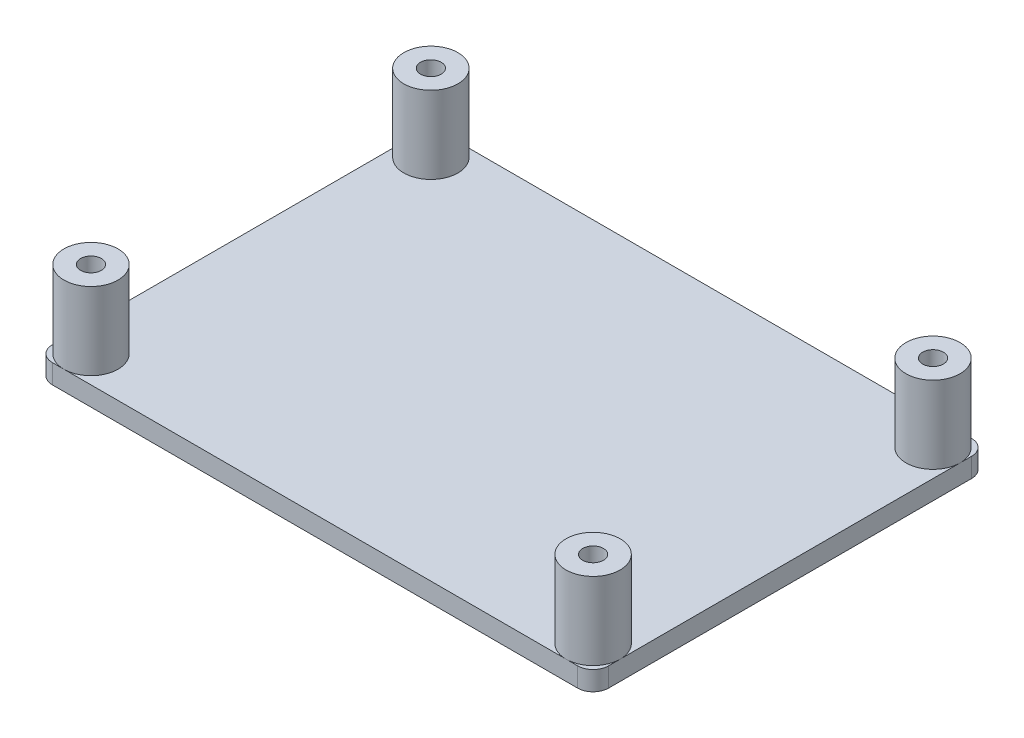
from build123d import *

# Parameters (mm, degrees)
SKETCH1_W           = 91.44
SKETCH1_H           = 64.77
BOSS_EXTRUDE1_DEPTH = 3.175
SKETCH2_R           = 4.445
BOSS_EXTRUDE2_DEPTH = 12.7
SKETCH3_R           = 1.6999966
CUT_EXTRUDE1_DEPTH  = 59.233343112
FILLET1_R           = 2.54


with BuildPart() as part:
    # Sketch1 → Boss-Extrude1 (new body)
    with BuildSketch(Plane(origin=(0, 0, 0), x_dir=(1, 0, 0), z_dir=(0, 1, 0))):
        Rectangle(SKETCH1_W, SKETCH1_H)
    extrude(amount=BOSS_EXTRUDE1_DEPTH)

    # Sketch2 → Boss-Extrude2 (add)
    with BuildSketch(Plane(origin=(0, 3.175, 0), x_dir=(1, 0, 0), z_dir=(0, 1, 0))):
        with Locations(Location((-41.275, 27.94, 0), (0, 0, 90))):
            Circle(SKETCH2_R)
        with Locations(Location((41.275, 27.94, 0), (0, 0, 90))):
            Circle(SKETCH2_R)
        with Locations(Location((41.275, -27.94, 0), (0, 0, 270))):
            Circle(SKETCH2_R)
        with Locations(Location((-41.275, -27.94, 0), (0, 0, 270))):
            Circle(SKETCH2_R)
    extrude(amount=BOSS_EXTRUDE2_DEPTH)

    # Sketch3 → Cut-Extrude1 (cut, through all)
    with BuildSketch(Plane(origin=(0, 15.875, 0), x_dir=(1, 0, 0), z_dir=(0, 1, 0))):
        with Locations(Location((-41.275, 27.94, 0), (0, 0, 270))):
            Circle(SKETCH3_R)
        with Locations(Location((41.275, 27.94, 0), (0, 0, 270))):
            Circle(SKETCH3_R)
        with Locations(Location((41.275, -27.94, 0), (0, 0, 270))):
            Circle(SKETCH3_R)
        with Locations(Location((-41.275, -27.94, 0), (0, 0, 270))):
            Circle(SKETCH3_R)
    extrude(amount=-CUT_EXTRUDE1_DEPTH, mode=Mode.SUBTRACT)

    # Fillet1
    fillet1_edges = [part.edges().sort_by_distance(p)[0] for p in [
        (45.72, 1.5875, 32.385),
        (-45.72, 1.5875, 32.385),
        (-45.72, 1.5875, -32.385),
        (45.72, 1.5875, -32.385),
    ]]
    fillet(fillet1_edges, radius=FILLET1_R)


solid = part.part
